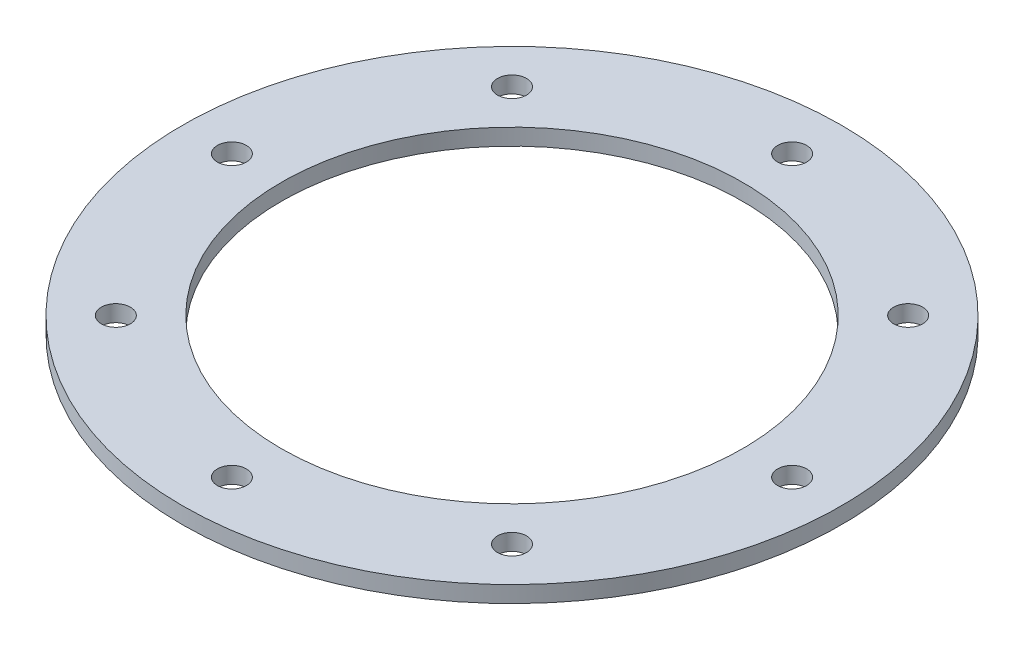
from build123d import *

# Parameters (mm, degrees)
SKETCH_1_R      = 100
SKETCH_1_R_2    = 70
SKETCH_1_R_3    = 4.4
EXTRUDE_1_DEPTH = 5


with BuildPart() as part:
    # Эскиз1 → Бобышка-Вытянуть1 (new body)
    with BuildSketch(Plane(origin=(0, 0, 0), x_dir=(1, 0, 0), z_dir=(0, 1, 0))):
        with Locations(Location((0, 0, 0), (0, 0, 270))):
            Circle(SKETCH_1_R)
        with Locations(Location((0, 0, 0), (0, 0, 270))):
            Circle(SKETCH_1_R_2, mode=Mode.SUBTRACT)
        with Locations(Location((85, 0, 0), (0, 0, 270))):
            Circle(SKETCH_1_R_3, mode=Mode.SUBTRACT)
        with Locations(Location((60.104076401, -60.104076401, 0), (0, 0, 270))):
            Circle(SKETCH_1_R_3, mode=Mode.SUBTRACT)
        with Locations(Location((0, -85, 0), (0, 0, 270))):
            Circle(SKETCH_1_R_3, mode=Mode.SUBTRACT)
        with Locations(Location((-60.104076401, -60.104076401, 0), (0, 0, 270))):
            Circle(SKETCH_1_R_3, mode=Mode.SUBTRACT)
        with Locations(Location((-85, 0, 0), (0, 0, 270))):
            Circle(SKETCH_1_R_3, mode=Mode.SUBTRACT)
        with Locations(Location((-60.104076401, 60.104076401, 0), (0, 0, 270))):
            Circle(SKETCH_1_R_3, mode=Mode.SUBTRACT)
        with Locations(Location((0, 85, 0), (0, 0, 270))):
            Circle(SKETCH_1_R_3, mode=Mode.SUBTRACT)
        with Locations(Location((60.104076401, 60.104076401, 0), (0, 0, 270))):
            Circle(SKETCH_1_R_3, mode=Mode.SUBTRACT)
    extrude(amount=EXTRUDE_1_DEPTH)


solid = part.part
